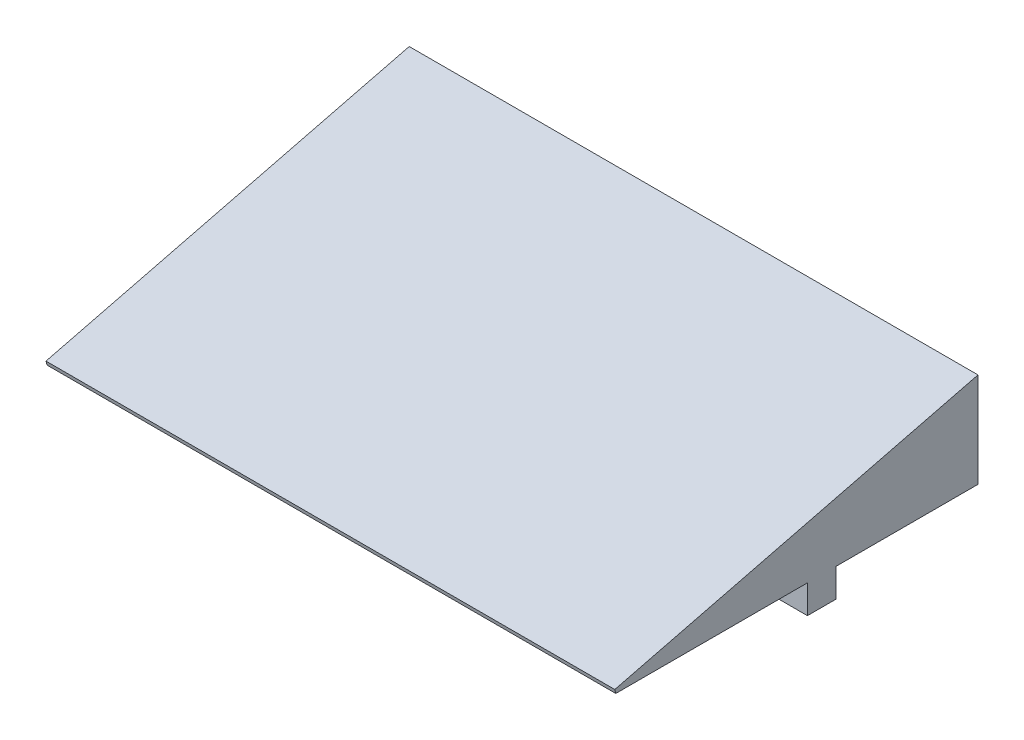
from build123d import *

# Parameters (mm, degrees)
SKETCH3_W               = 120
SKETCH3_H               = 80
BOSS_EXTRUDE1_DEPTH     = 20
CUT_EXTRUDE3_DEPTH      = 129.062484749
CUT_EXTRUDE3_DEPTH_BACK = 120
SKETCH5_W               = 6
SKETCH5_H               = 6
BOSS_EXTRUDE2_DEPTH     = 120
SKETCH6_W               = 120
SKETCH6_H               = 3.448417199
CUT_EXTRUDE4_DEPTH      = 10


with BuildPart() as part:
    # Sketch3 → Boss-Extrude1 (new body)
    with BuildSketch(Plane(origin=(0, 0, 0), x_dir=(1, 0, 0), z_dir=(0, 1, 0))):
        Rectangle(SKETCH3_W, SKETCH3_H)
    extrude(amount=BOSS_EXTRUDE1_DEPTH)

    # Sketch4 → Cut-Extrude3 (cut, two sides: drawn at the far end of the back side and taken through both)
    with BuildSketch(Plane(origin=(60, 0, 0), x_dir=(0, 0, -1), z_dir=(1, 0, 0)).offset(-CUT_EXTRUDE3_DEPTH_BACK)):
        Polygon((-40, 20), (-40, 0), (-39.971354494, 0), (40, 20), align=None)
    extrude(amount=CUT_EXTRUDE3_DEPTH + CUT_EXTRUDE3_DEPTH_BACK, mode=Mode.SUBTRACT)

    # Sketch5 → Boss-Extrude2 (add)
    with BuildSketch(Plane(origin=(60, 0, 0), x_dir=(0, 0, -1), z_dir=(1, 0, 0))):
        with Locations((7.014322753, -3)):
            Rectangle(SKETCH5_W, SKETCH5_H)
    extrude(amount=-BOSS_EXTRUDE2_DEPTH)

    # Sketch6 → Cut-Extrude4 (cut)
    with BuildSketch(Plane(origin=(0, 9.407996907, 2.352841706), x_dir=(1, 0, 0), z_dir=(0, 0.9701220558238487, 0.2426173876788501))):
        with Locations((0, -37.052883997)):
            Rectangle(SKETCH6_W, SKETCH6_H)
    extrude(amount=-CUT_EXTRUDE4_DEPTH, mode=Mode.SUBTRACT)


solid = part.part
